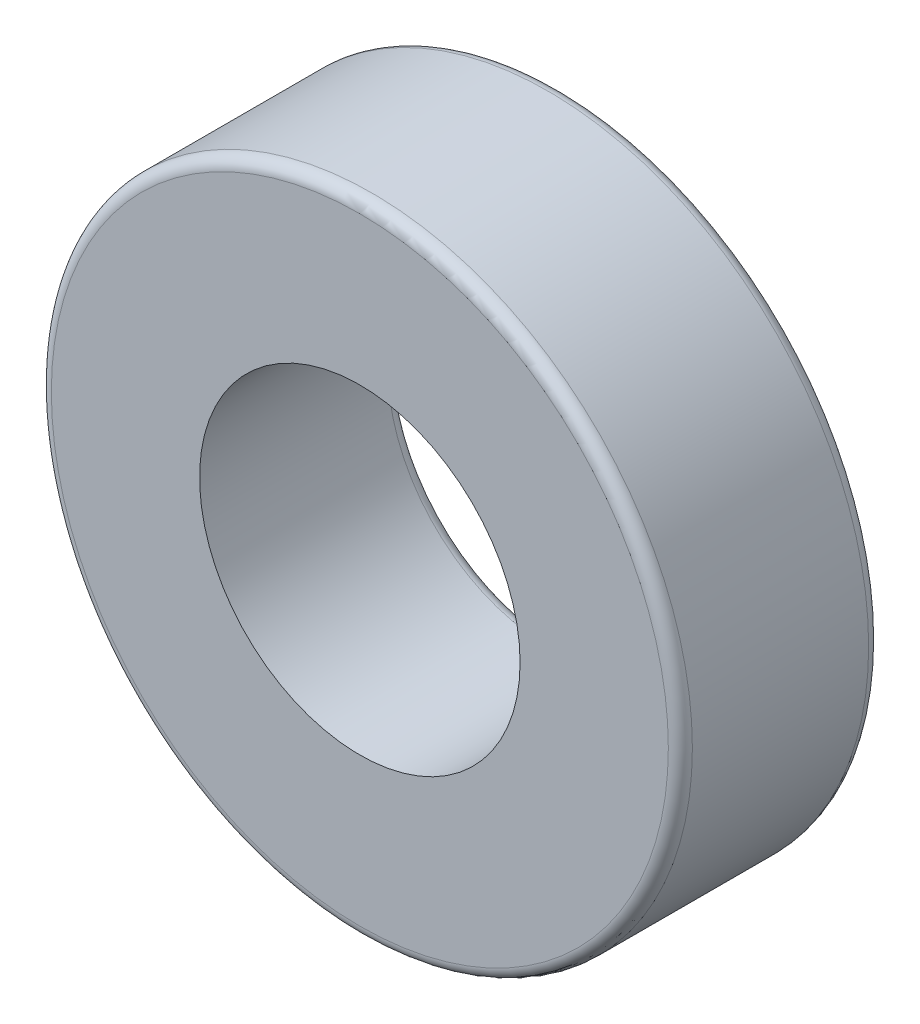
from build123d import *

# Parameters (mm, degrees)
SKETCH1_R           = 8
SKETCH1_R_2         = 4
BOSS_EXTRUDE1_DEPTH = 2.5
FILLET2_R           = 0.3


with BuildPart() as part:
    # Sketch1 → Boss-Extrude1 (new, symmetric)
    with BuildSketch(Plane.XY):
        Circle(SKETCH1_R)
        Circle(SKETCH1_R_2, mode=Mode.SUBTRACT)
    extrude(amount=BOSS_EXTRUDE1_DEPTH, both=True)

    # Fillet2
    fillet2_edges = [part.edges().sort_by_distance(p)[0] for p in [
        (-8, 0, -2.5),
        (-8, 0, 2.5),
        (-4, 0, -2.5),
    ]]
    fillet(fillet2_edges, radius=FILLET2_R)


solid = part.part
